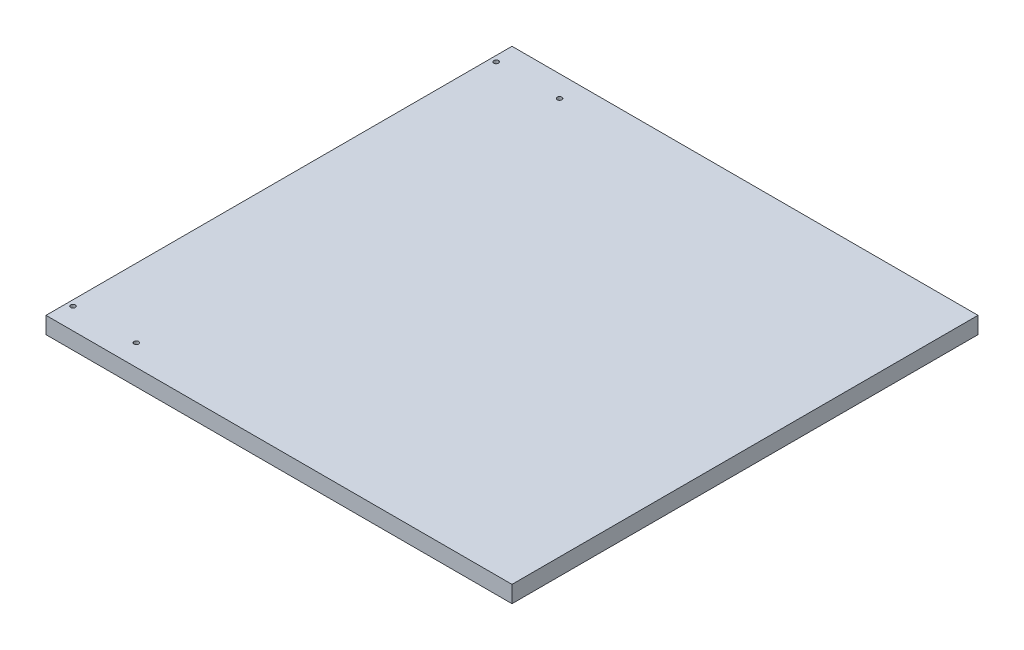
from build123d import *

# Parameters (mm, degrees)
SKETCH1_W           = 500
SKETCH1_H           = 500
BOSS_EXTRUDE2_DEPTH = 9
SKETCH2_R           = 2.5
CUT_EXTRUDE1_DEPTH  = 355.011299255
CHAMFER1_SIZE       = 2


with BuildPart() as part:
    # Sketch1 → Boss-Extrude2 (new, symmetric)
    with BuildSketch(Plane(origin=(0, 0, 0), x_dir=(1, 0, 0), z_dir=(0, 1, 0))):
        Rectangle(SKETCH1_W, SKETCH1_H)
    extrude(amount=BOSS_EXTRUDE2_DEPTH, both=True)

    # Sketch2 → Cut-Extrude1 (cut, through all)
    with BuildSketch(Plane(origin=(0, 9, 0), x_dir=(1, 0, 0), z_dir=(0, 1, 0))):
        with Locations(Location((-176, 227, 0), (0, 0, 270))):
            Circle(SKETCH2_R)
        with Locations(Location((-244, 227, 0), (0, 0, 90))):
            Circle(SKETCH2_R)
        with Locations(Location((-244, -227, 0), (0, 0, 270))):
            Circle(SKETCH2_R)
        with Locations(Location((-176, -227, 0), (0, 0, 90))):
            Circle(SKETCH2_R)
    extrude(amount=-CUT_EXTRUDE1_DEPTH, mode=Mode.SUBTRACT)

    # Chamfer1
    chamfer1_edges = [part.edges().sort_by_distance(p)[0] for p in [
        (-244, -9, -224.5),
        (-176, -9, -229.5),
        (-176, -9, 229.5),
        (-244, -9, 224.5),
    ]]
    chamfer(chamfer1_edges, length=CHAMFER1_SIZE)


solid = part.part
